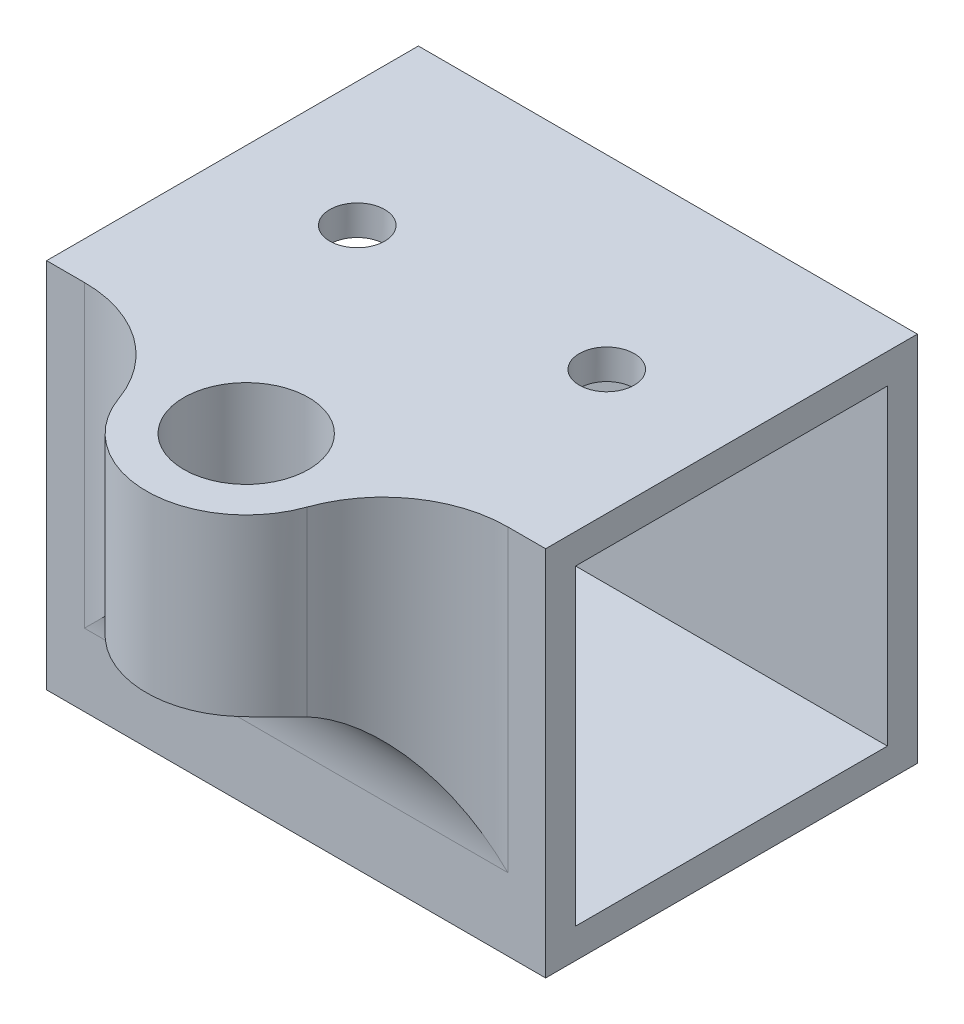
from build123d import *

# Parameters (mm, degrees)
SKETCH_1_W          = 29.8
SKETCH_1_H          = 29.8
SKETCH_1_W_2        = 25
SKETCH_1_H_2        = 25
EXTRUDE_1_DEPTH     = 40
SKETCH_2_R          = 8
SKETCH_2_R_2        = 5
EXTRUDE_1_2_DEPTH   = 10
SKETCH_3_R          = 8
EXTRUDE_2_DEPTH     = 4
FILLET_1_R          = 10
CUT_EXTRUDE_1_REACH = 58.671
SKETCH_4_R          = 2.2
SKETCH_5_R          = 5
CUT_EXTRUDE_2_DEPTH = 10
CUT_EXTRUDE_3_REACH = 52.454
SKETCH_6_W          = 25
SKETCH_6_H          = 25
SKETCH_7_R          = 3.2
SKETCH_7_R_2        = 1.2
EXTRUDE_3_DEPTH     = 4
FILLET_2_R          = 10


with BuildPart() as part:
    # Эскиз1 → Extrude 1 (new body)
    with BuildSketch(Plane(origin=(0, 0, 0), x_dir=(0, 0, -1), z_dir=(1, 0, 0))):
        Rectangle(SKETCH_1_W, SKETCH_1_H)
        Rectangle(SKETCH_1_W_2, SKETCH_1_H_2, mode=Mode.SUBTRACT)
    extrude(amount=EXTRUDE_1_DEPTH)

    # Эскиз2 → Extrude 1 2 (add)
    with BuildSketch(Plane(origin=(0, 14.9, 0), x_dir=(1, 0, 0), z_dir=(0, 1, 0))):
        with Locations((20, -18.9)):
            Circle(SKETCH_2_R)
        with Locations((20, -18.9)):
            Circle(SKETCH_2_R_2, mode=Mode.SUBTRACT)
    extrude(amount=-EXTRUDE_1_2_DEPTH)

    # Эскиз3 → Бобышка-Вытянуть2 (add)
    with BuildSketch(Plane.XZ.offset(-4.9)):
        with Locations((20, 18.9)):
            Circle(SKETCH_3_R)
    extrude(amount=EXTRUDE_2_DEPTH)

    # Скругление1
    fillet_1_edges = [part.edges().sort_by_distance(p)[0] for p in [
        (13.07179677, 7.9, 14.9),
        (26.92820323, 7.9, 14.9),
        (20, 0.9, 14.9),
    ]]
    fillet(fillet_1_edges, radius=FILLET_1_R)

    # Эскиз4 → Вырез-Вытянуть1 (cut, up to next)
    with BuildSketch(Plane(origin=(0, 14.9, 0), x_dir=(1, 0, 0), z_dir=(0, 1, 0)), mode=Mode.PRIVATE) as cut_extrude_1_sk1:
        with Locations(Location((10, 0, 0), (0, 0, 270))):
            Circle(SKETCH_4_R)
    cut_extrude_1_tool1 = extrude(cut_extrude_1_sk1.sketch, amount=-CUT_EXTRUDE_1_REACH, mode=Mode.PRIVATE) & part.part
    # Эскиз4 → Вырез-Вытянуть1 (cut, up to next)
    with BuildSketch(Plane(origin=(0, 14.9, 0), x_dir=(1, 0, 0), z_dir=(0, 1, 0)), mode=Mode.PRIVATE) as cut_extrude_1_sk2:
        with Locations(Location((30, 0, 0), (0, 0, 270))):
            Circle(SKETCH_4_R)
    cut_extrude_1_tool2 = extrude(cut_extrude_1_sk2.sketch, amount=-CUT_EXTRUDE_1_REACH, mode=Mode.PRIVATE) & part.part
    add(cut_extrude_1_tool1.solids().sort_by_distance((10, 14.9, 0))[0], mode=Mode.SUBTRACT)
    add(cut_extrude_1_tool2.solids().sort_by_distance((30, 14.9, 0))[0], mode=Mode.SUBTRACT)

    # Эскиз5 → Вырез-Вытянуть2 (cut)
    with BuildSketch(Plane(origin=(0, 14.9, 0), x_dir=(1, 0, 0), z_dir=(0, 1, 0))):
        with Locations(Location((20, -18.9, 0), (0, 0, 270))):
            Circle(SKETCH_5_R)
    extrude(amount=-CUT_EXTRUDE_2_DEPTH, mode=Mode.SUBTRACT)

    # Эскиз6 → Вырез-Вытянуть3 (cut, up to next)
    with BuildSketch(Plane(origin=(40, 0, 0), x_dir=(0, 0, -1), z_dir=(1, 0, 0)), mode=Mode.PRIVATE) as cut_extrude_3_sk1:
        Rectangle(SKETCH_6_W, SKETCH_6_H)
    cut_extrude_3_tool1 = extrude(cut_extrude_3_sk1.sketch, amount=-CUT_EXTRUDE_3_REACH, mode=Mode.PRIVATE) & part.part
    add(cut_extrude_3_tool1.solids().sort_by_distance((40, 0, 0))[0], mode=Mode.SUBTRACT)

    # Эскиз7 → Бобышка-Вытянуть3 (add)
    with BuildSketch(Plane.XZ.offset(14.9)):
        with Locations((20, -17.9)):
            Circle(SKETCH_7_R)
        with Locations(Location((20, -17.9, 0), (0, 0, 270))):
            Circle(SKETCH_7_R_2, mode=Mode.SUBTRACT)
    extrude(amount=-EXTRUDE_3_DEPTH)

    # Скругление2
    fillet_2_edges = [part.edges().sort_by_distance(p)[0] for p in [
        (18.886447127, -12.9, -14.9),
        (21.113552873, -12.9, -14.9),
    ]]
    fillet(fillet_2_edges, radius=FILLET_2_R)


solid = part.part
